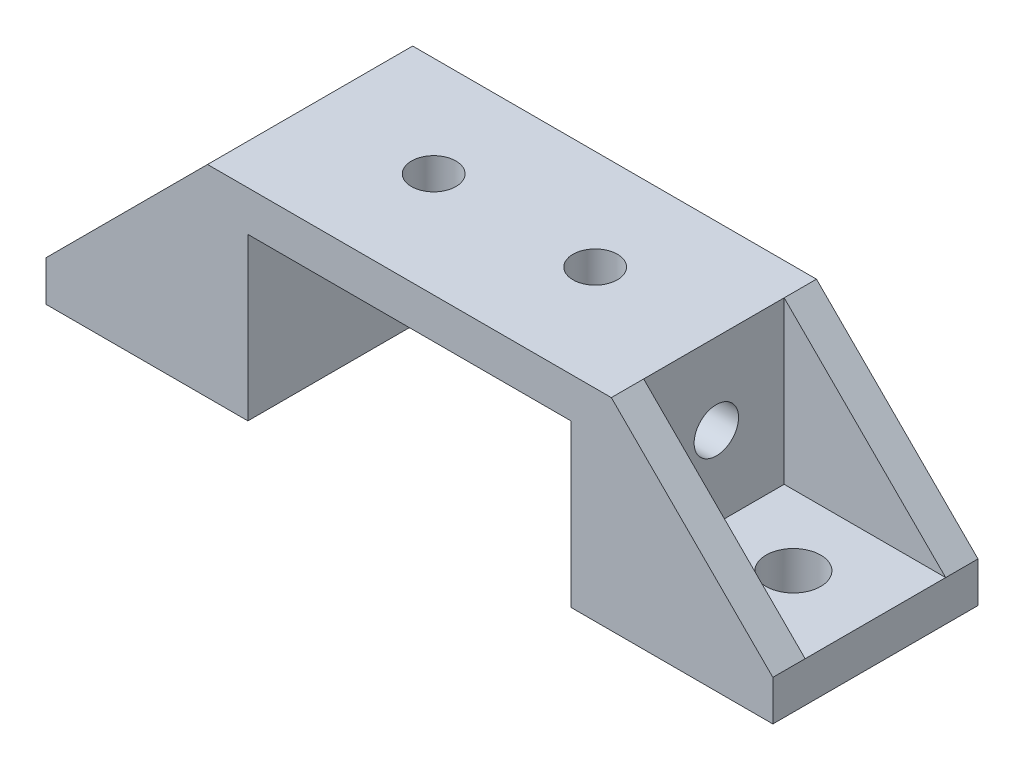
from build123d import *

# Parameters (mm, degrees)
BOSS_EXTRUDE1_DEPTH  = 25.4
BOSS_EXTRUDE2_DEPTH  = 4
MIRROR2_COPY_1_DEPTH = 4


with BuildPart() as part:
    # Sketch1 → Boss-Extrude1 (new body)
    with BuildSketch(Plane.XY):
        Polygon((-25, 15), (-25, -5), (-45, -5), (-45, -10), (-20, -10), (-20, 10), (0, 10), (0, 15), align=None)
    boss_extrude1 = extrude(amount=BOSS_EXTRUDE1_DEPTH)

    # Sketch1<3> → Boss-Extrude2 (add)
    with BuildSketch(Plane.XY):
        Polygon((-25, -5), (-25, 15), (-45, -5), align=None)
    boss_extrude2 = extrude(amount=BOSS_EXTRUDE2_DEPTH)

    # Mirror1: Boss-Extrude2 across plane
    add(boss_extrude2.mirror(Plane.XY.offset(12.7)))

    # Sketch3 → M5 Clearance Hole1 (revolve, cut)
    with BuildSketch(Plane(origin=(-10, 15, 12.4), x_dir=(0, 0, 1), z_dir=(1, 0, 0))):
        Polygon((0, 0), (0, 13.652366702), (2.75, 12), (2.75, 0), align=None)
    m5_clearance_hole1 = revolve(axis=Axis((-10, 21.35, 12.4), (0, -1, 0)), mode=Mode.SUBTRACT)

    # Sketch5 → M5 Clearance Hole2 (revolve, cut)
    with BuildSketch(Plane(origin=(-25, 5, 12.4), x_dir=(0, 0, 1), z_dir=(0, 1, 0))):
        Polygon((0, 0), (0, 13.652366702), (2.75, 12), (2.75, 0), align=None)
    m5_clearance_hole2 = revolve(axis=Axis((-31.35, 5, 12.4), (1, 0, 0)), mode=Mode.SUBTRACT)

    # Sketch7 → 1/4 Clearance Hole1 (revolve, cut)
    with BuildSketch(Plane(origin=(-34.84, -5, 12.7), x_dir=(0, 0, 1), z_dir=(1, 0, 0))):
        Polygon((0, 0), (0, 14.029827343), (3.3782, 12), (3.3782, 0), align=None)
    f_1_4_clearance_hole1 = revolve(axis=Axis((-34.84, 1.35, 12.7), (0, -1, 0)), mode=Mode.SUBTRACT)

    # Mirror2: Boss-Extrude1, Boss-Extrude2, M5 Clearance Hole1, M5 Clearance Hole2, 1/4 Clearance Hole1 across plane
    add(boss_extrude1.mirror(Plane(origin=(0, 0, 0), x_dir=(0, 0, 1), z_dir=(1, 0, 0))))
    add(boss_extrude2.mirror(Plane(origin=(0, 0, 0), x_dir=(0, 0, 1), z_dir=(1, 0, 0))))
    add(m5_clearance_hole1.mirror(Plane(origin=(0, 0, 0), x_dir=(0, 0, 1), z_dir=(1, 0, 0))), mode=Mode.SUBTRACT)
    add(m5_clearance_hole2.mirror(Plane(origin=(0, 0, 0), x_dir=(0, 0, 1), z_dir=(1, 0, 0))), mode=Mode.SUBTRACT)
    add(f_1_4_clearance_hole1.mirror(Plane(origin=(0, 0, 0), x_dir=(0, 0, 1), z_dir=(1, 0, 0))), mode=Mode.SUBTRACT)

    # Mirror2 copy 1 sketch → Mirror2 copy 1 (add)
    with BuildSketch(Plane(origin=(0, 0, 25.4), x_dir=(-1, 0, 0), z_dir=(0, 0, -1))):
        Polygon((-25, -5), (-25, 15), (-45, -5), align=None)
    extrude(amount=MIRROR2_COPY_1_DEPTH)


solid = part.part
